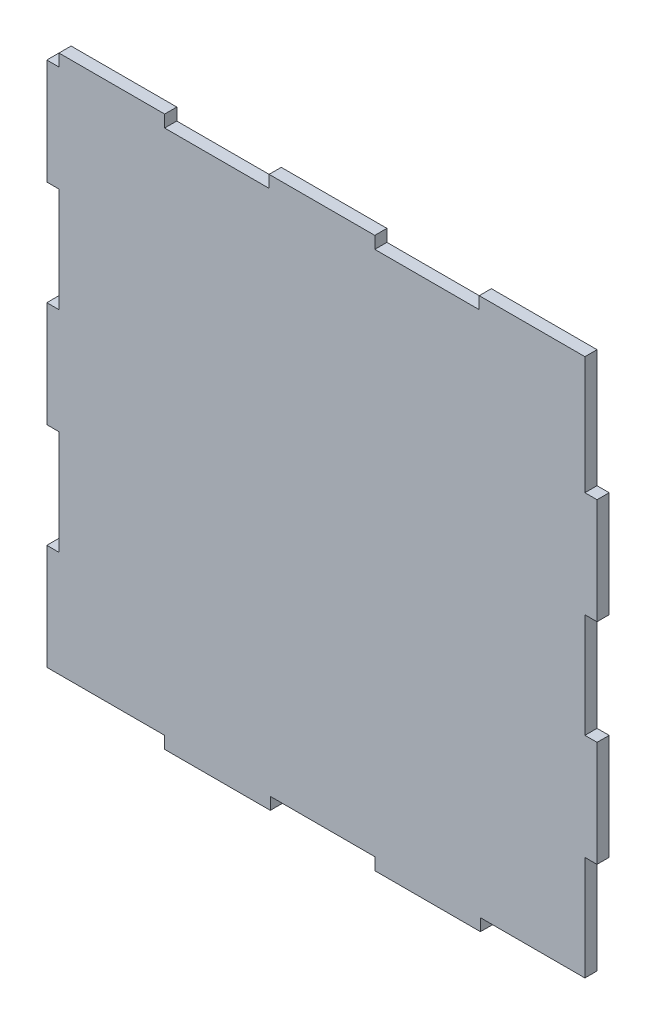
from build123d import *

# Parameters (mm, degrees)
BOSS_EXTRUDE1_DEPTH = 3


with BuildPart() as part:
    # Sketch2 → Boss-Extrude1 (new body)
    with BuildSketch(Plane.XY):
        Polygon((65, 38.88), (68, 38.88), (68, 12.76), (65, 12.76), (65, -13.06), (68, -13.06), (68, -39.18), (65, -39.18), (65, -65), (39.18, -65), (39.18, -68), (13.06, -68), (13.06, -65), (-12.76, -65), (-12.76, -68), (-38.88, -68), (-38.88, -65), (-64.7, -65), (-68, -65), (-68, -38.88), (-65, -38.88), (-65, -13.06), (-68, -13.06), (-68, 13.06), (-65, 13.06), (-65, 38.88), (-68, 38.88), (-68, 65), (-65, 65), (-65, 68), (-38.88, 68), (-38.88, 65), (-13.06, 65), (-13.06, 68), (13.06, 68), (13.06, 65), (38.88, 65), (38.88, 68), (65, 68), (65, 64.7), align=None)
    extrude(amount=BOSS_EXTRUDE1_DEPTH)


solid = part.part
